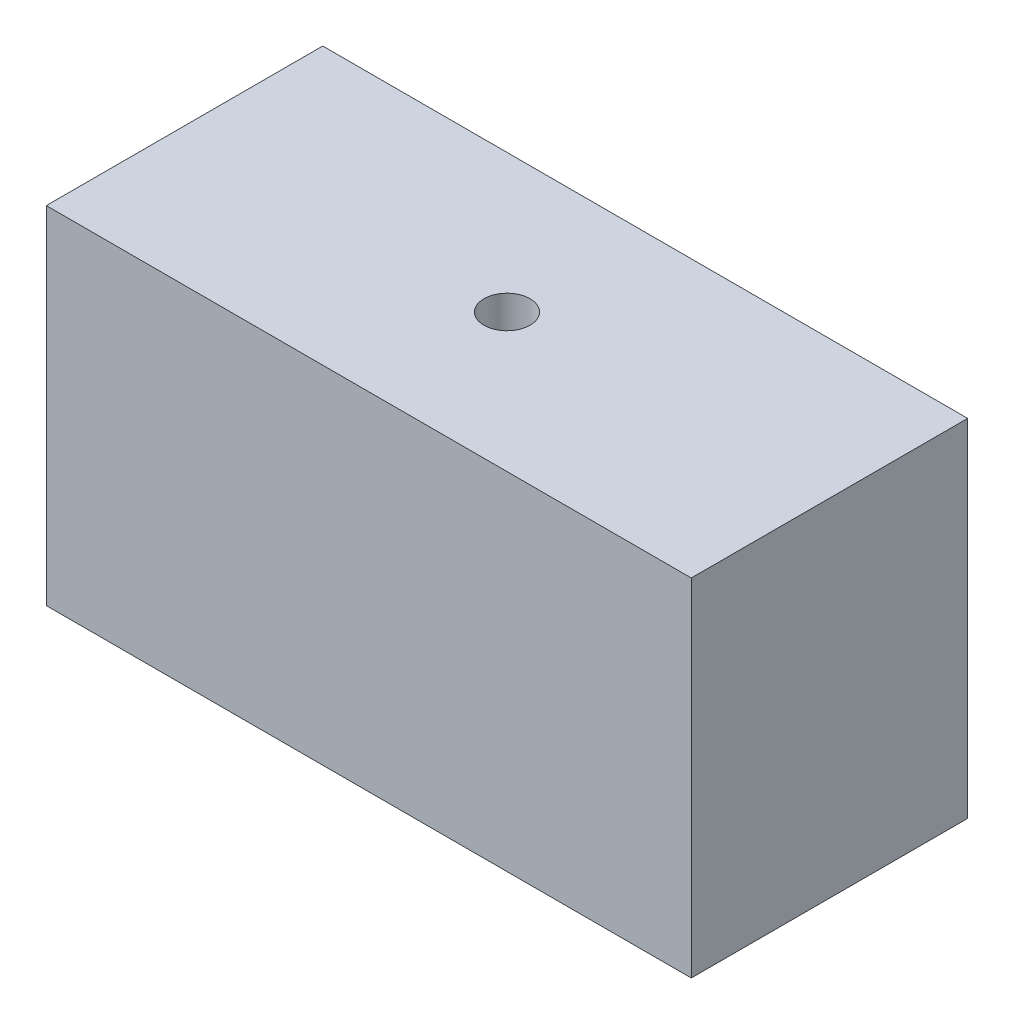
from build123d import *

# Parameters (mm, degrees)
SKETCH1_W           = 88.9
SKETCH1_H           = 38.1
SKETCH1_R           = 3.175
BOSS_EXTRUDE1_DEPTH = 47.752


with BuildPart() as part:
    # Sketch1 → Boss-Extrude1 (new body)
    with BuildSketch(Plane(origin=(0, 0, 0), x_dir=(1, 0, 0), z_dir=(0, 1, 0))):
        with Locations((44.45, 19.05)):
            Rectangle(SKETCH1_W, SKETCH1_H)
        with Locations(Location((44.45, 19.05, 0), (0, 0, 270))):
            Circle(SKETCH1_R, mode=Mode.SUBTRACT)
    extrude(amount=BOSS_EXTRUDE1_DEPTH)


solid = part.part
